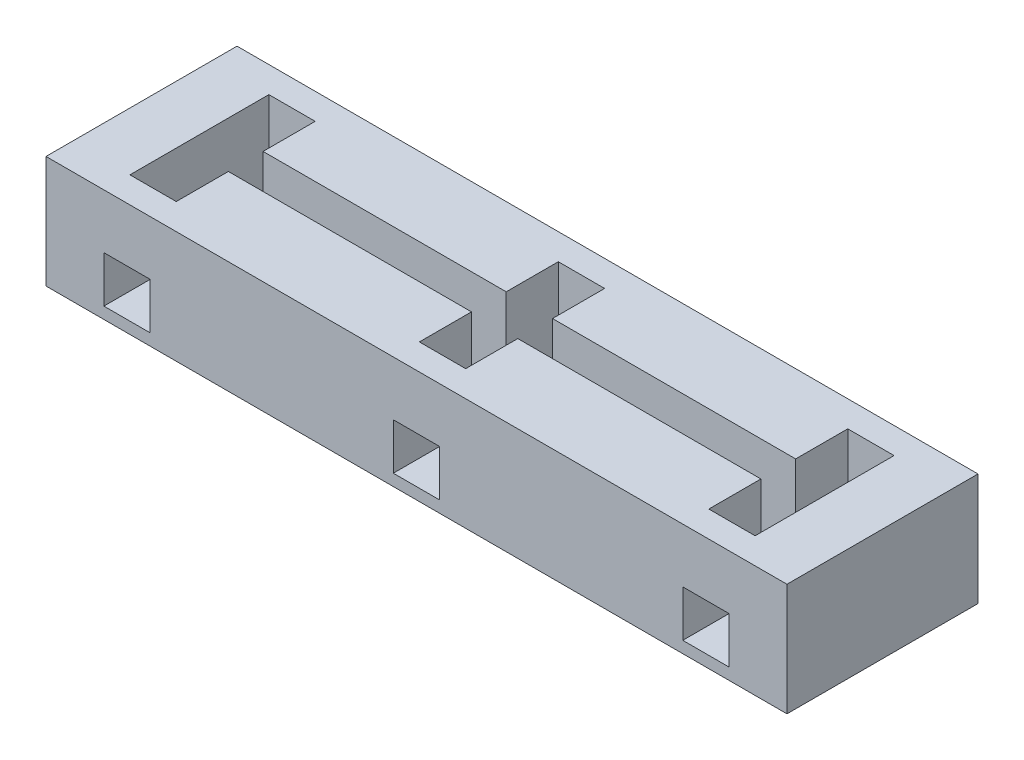
from build123d import *

# Parameters (mm, degrees)
SKETCH1_W           = 320
SKETCH1_H           = 82.5
BOSS_EXTRUDE1_DEPTH = 43.48
SKETCH3_W           = 20
SKETCH3_H           = 20
CUT_EXTRUDE1_DEPTH  = 15
SKETCH5_W           = 320
SKETCH5_H           = 82.5
BOSS_EXTRUDE3_DEPTH = 5


with BuildPart() as part:
    # Sketch1 → Boss-Extrude1 (new body)
    with BuildSketch(Plane(origin=(0, 0, 0), x_dir=(1, 0, 0), z_dir=(0, 1, 0))):
        Rectangle(SKETCH1_W, SKETCH1_H)
        Polygon((-135, 30), (-115, 30), (-115, 7.5), (-10, 7.5), (-10, 30), (10, 30), (10, 7.5), (115, 7.5), (115, 30), (135, 30), (135, -30), (115, -30), (115, -7.5), (10, -7.5), (10, -30), (-10, -30), (-10, -7.5), (-115, -7.5), (-115, -30), (-135, -30), align=None, mode=Mode.SUBTRACT)
    extrude(amount=-BOSS_EXTRUDE1_DEPTH)

    # Sketch3 → Cut-Extrude1 (cut)
    with BuildSketch(Plane.XY.offset(41.25)):
        with Locations((0, -33.48)):
            Rectangle(SKETCH3_W, SKETCH3_H)
        with Locations((125, -33.48)):
            Rectangle(SKETCH3_W, SKETCH3_H)
        with Locations((-125, -33.48)):
            Rectangle(SKETCH3_W, SKETCH3_H)
    extrude(amount=-CUT_EXTRUDE1_DEPTH, mode=Mode.SUBTRACT)

    # Sketch5 → Boss-Extrude3 (add)
    with BuildSketch(Plane.XZ.offset(43.48)):
        Rectangle(SKETCH5_W, SKETCH5_H)
    extrude(amount=BOSS_EXTRUDE3_DEPTH)


solid = part.part
